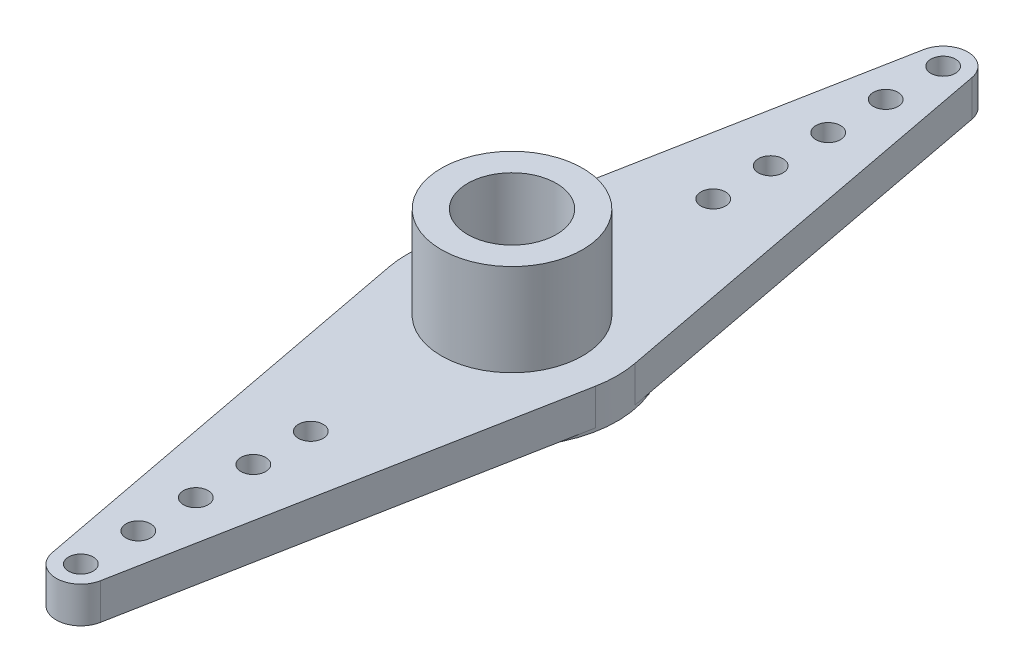
from build123d import *
from build123d.topology import SkipClean

# Parameters (mm, degrees)
SKETCH1_R               = 1.5
BOSS_EXTRUDE1_DEPTH     = 2.2
SKETCH3_R               = 4.3
SKETCH3_R_2             = 2.7
BOSS_EXTRUDE2_DEPTH     = 5.6
BOSS_EXTRUDE3_START     = 0.2
SKETCH4_R               = 6.4
SKETCH4_R_2             = 2.7
BOSS_EXTRUDE3_DEPTH     = 0.2
SKETCH7_R               = 2.7
CUT_EXTRUDE1_DEPTH      = 1.5
CUT_EXTRUDE2_REACH      = 31.527
SKETCH8_R               = 0.75
LPATTERN1_COUNT         = 5
LPATTERN1_PITCH         = 3.5
MIRROR1_COPY_1_REACH    = 31.527
MIRROR1_COPY_1_SKETCH_R = 0.75
MIRROR1_COPY_2_REACH    = 31.527
MIRROR1_COPY_2_SKETCH_R = 0.75
MIRROR1_COPY_3_REACH    = 31.527
MIRROR1_COPY_3_SKETCH_R = 0.75
MIRROR1_COPY_4_REACH    = 31.527
MIRROR1_COPY_4_SKETCH_R = 0.75


with BuildPart() as part:
    # Sketch1 → Boss-Extrude1 (new body)
    with BuildSketch(Plane(origin=(0, 0, 0), x_dir=(1, 0, 0), z_dir=(0, 1, 0))):
        with BuildLine():
            Line((-1.473634962, 26.53), (-6.287509169, 1.194666667))
            ThreePointArc((-6.287509169, 1.194666667), (-6.4, 0), (-6.287509169, -1.194666667))
            Line((-6.287509169, -1.194666667), (-1.473634962, -26.53))
            ThreePointArc((-1.473634962, -26.53), (0, -27.75), (1.473634962, -26.53))
            Line((1.473634962, -26.53), (6.287509169, -1.194666667))
            ThreePointArc((6.287509169, -1.194666667), (6.4, 0), (6.287509169, 1.194666667))
            Line((6.287509169, 1.194666667), (1.473634962, 26.53))
            ThreePointArc((1.473634962, 26.53), (0, 27.75), (-1.473634962, 26.53))
        make_face()
        with Locations(Location((0, 0, 0), (0, 0, 270))):
            Circle(SKETCH1_R, mode=Mode.SUBTRACT)
    extrude(amount=BOSS_EXTRUDE1_DEPTH)

    # Sketch3 → Boss-Extrude2 (add)
    with BuildSketch(Plane(origin=(0, 2.2, 0), x_dir=(1, 0, 0), z_dir=(0, 1, 0))):
        with Locations(Location((0, 0, 0), (0, 0, 270))):
            Circle(SKETCH3_R)
        with Locations(Location((0, 0, 0), (0, 0, 270))):
            Circle(SKETCH3_R_2, mode=Mode.SUBTRACT)
    extrude(amount=BOSS_EXTRUDE2_DEPTH)

    # Sketch4 → Boss-Extrude3 (add)
    with SkipClean():  # the faces are left unmerged after this step: merging them gives an invalid solid
        with BuildSketch(Plane.XZ.offset(BOSS_EXTRUDE3_START)):
            with Locations(Location((0, 0, 0), (0, 0, 270))):
                Circle(SKETCH4_R)
            with Locations(Location((0, 0, 0), (0, 0, 90))):
                Circle(SKETCH4_R_2, mode=Mode.SUBTRACT)
        extrude(amount=-BOSS_EXTRUDE3_DEPTH)

    # Sketch7 → Cut-Extrude1 (cut)
    with SkipClean():  # the faces are left unmerged after this step: merging them gives an invalid solid
        with BuildSketch(Plane.XZ):
            with Locations(Location((0, 0, 0), (0, 0, 90))):
                Circle(SKETCH7_R)
        extrude(amount=-CUT_EXTRUDE1_DEPTH, mode=Mode.SUBTRACT)

    # Sketch8 → Cut-Extrude2 (cut, up to next)
    with BuildSketch(Plane.XZ, mode=Mode.PRIVATE) as cut_extrude2_sk1:
        with Locations(Location((0, 12.25, 0), (0, 0, 270))):
            Circle(SKETCH8_R)
    cut_extrude2_tool1 = extrude(cut_extrude2_sk1.sketch, amount=-CUT_EXTRUDE2_REACH, mode=Mode.PRIVATE) & part.part
    cut_extrude2 = cut_extrude2_tool1.solids().sort_by_distance((0, 0, 12.25))[0]
    add(cut_extrude2, mode=Mode.SUBTRACT)

    # LPattern1: Cut-Extrude2 ×5
    with SkipClean():  # the faces are left unmerged after this step: merging them gives an invalid solid
        with Locations(*[(0, 0, i * LPATTERN1_PITCH) for i in range(1, LPATTERN1_COUNT)]):
            add(cut_extrude2, mode=Mode.SUBTRACT)

    # Mirror1: Cut-Extrude2 across plane
    with SkipClean():  # the faces are left unmerged after this step: merging them gives an invalid solid
        add(cut_extrude2.mirror(Plane.XY), mode=Mode.SUBTRACT)

    # Mirror1 copy 1 sketch → Mirror1 copy 1 (cut, up to next)
    with BuildSketch(Plane(origin=(0, 0, -3.5), x_dir=(1, 0, 0), z_dir=(0, -1, 0)), mode=Mode.PRIVATE) as mirror1_copy_1_sk1:
        with Locations((0, -12.25)):
            Circle(MIRROR1_COPY_1_SKETCH_R)
    mirror1_copy_1_tool1 = extrude(mirror1_copy_1_sk1.sketch, amount=-MIRROR1_COPY_1_REACH, mode=Mode.PRIVATE) & part.part
    add(mirror1_copy_1_tool1.solids().sort_by_distance((0, 0, -15.75))[0], mode=Mode.SUBTRACT)

    # Mirror1 copy 2 sketch → Mirror1 copy 2 (cut, up to next)
    with BuildSketch(Plane(origin=(0, 0, -7), x_dir=(1, 0, 0), z_dir=(0, -1, 0)), mode=Mode.PRIVATE) as mirror1_copy_2_sk1:
        with Locations((0, -12.25)):
            Circle(MIRROR1_COPY_2_SKETCH_R)
    mirror1_copy_2_tool1 = extrude(mirror1_copy_2_sk1.sketch, amount=-MIRROR1_COPY_2_REACH, mode=Mode.PRIVATE) & part.part
    add(mirror1_copy_2_tool1.solids().sort_by_distance((0, 0, -19.25))[0], mode=Mode.SUBTRACT)

    # Mirror1 copy 3 sketch → Mirror1 copy 3 (cut, up to next)
    with BuildSketch(Plane(origin=(0, 0, -10.5), x_dir=(1, 0, 0), z_dir=(0, -1, 0)), mode=Mode.PRIVATE) as mirror1_copy_3_sk1:
        with Locations((0, -12.25)):
            Circle(MIRROR1_COPY_3_SKETCH_R)
    mirror1_copy_3_tool1 = extrude(mirror1_copy_3_sk1.sketch, amount=-MIRROR1_COPY_3_REACH, mode=Mode.PRIVATE) & part.part
    add(mirror1_copy_3_tool1.solids().sort_by_distance((0, 0, -22.75))[0], mode=Mode.SUBTRACT)

    # Mirror1 copy 4 sketch → Mirror1 copy 4 (cut, up to next)
    with BuildSketch(Plane(origin=(0, 0, -14), x_dir=(1, 0, 0), z_dir=(0, -1, 0)), mode=Mode.PRIVATE) as mirror1_copy_4_sk1:
        with Locations((0, -12.25)):
            Circle(MIRROR1_COPY_4_SKETCH_R)
    mirror1_copy_4_tool1 = extrude(mirror1_copy_4_sk1.sketch, amount=-MIRROR1_COPY_4_REACH, mode=Mode.PRIVATE) & part.part
    add(mirror1_copy_4_tool1.solids().sort_by_distance((0, 0, -26.25))[0], mode=Mode.SUBTRACT)


solid = part.part
